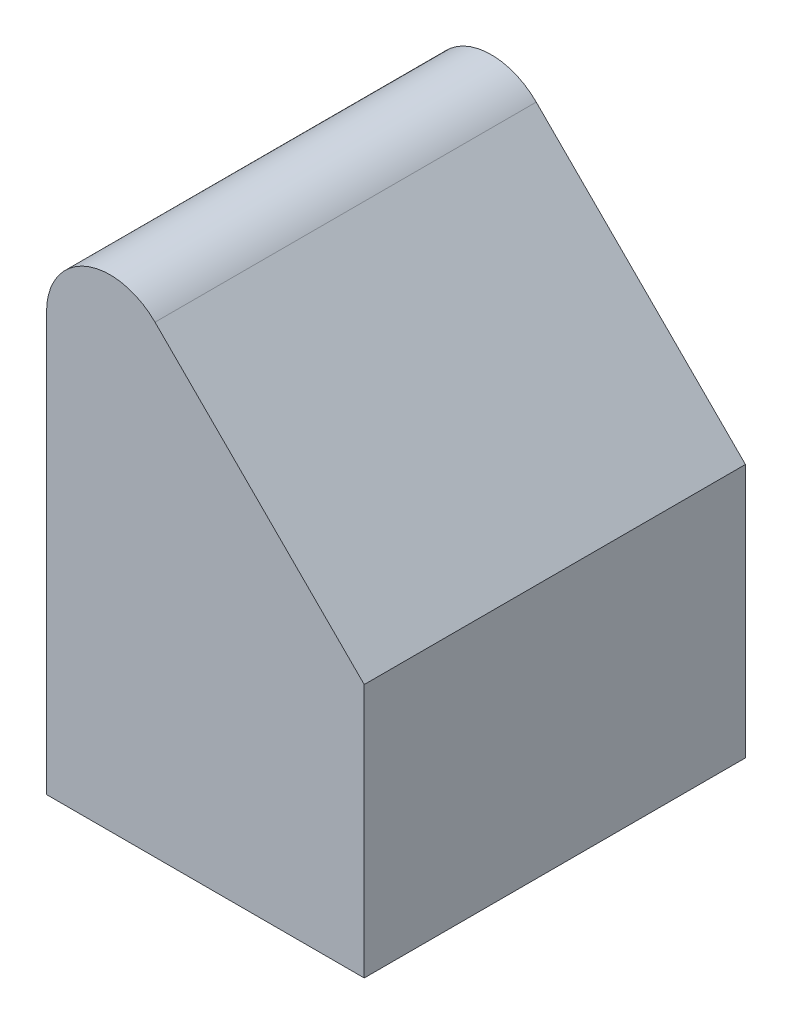
from build123d import *

# Parameters (mm, degrees)
CROQUIS2_W              = 30
CROQUIS2_H              = 20
SALIENTE_EXTRUIR2_DEPTH = 25
SALIENTE_EXTRUIR3_DEPTH = 30
REDONDEO1_R             = 5


with BuildPart() as part:
    # Croquis2 → Saliente-Extruir2 (new body)
    with BuildSketch(Plane(origin=(0, 0, 0), x_dir=(0, 0, -1), z_dir=(1, 0, 0))):
        with Locations((-15, -10)):
            Rectangle(CROQUIS2_W, CROQUIS2_H)
    extrude(amount=SALIENTE_EXTRUIR2_DEPTH)

    # Croquis3 → Saliente-Extruir3 (add, through all)
    with BuildSketch(Plane(origin=(0, 0, 0), x_dir=(-1, 0, 0), z_dir=(0, 0, -1))):
        Polygon((0, 0), (0, 25), (-25, 0), align=None)
    extrude(amount=-SALIENTE_EXTRUIR3_DEPTH)

    # Redondeo1
    redondeo1_edges = [part.edges().sort_by_distance(p)[0] for p in [
        (0, 25, 15),
    ]]
    fillet(redondeo1_edges, radius=REDONDEO1_R)


solid = part.part
